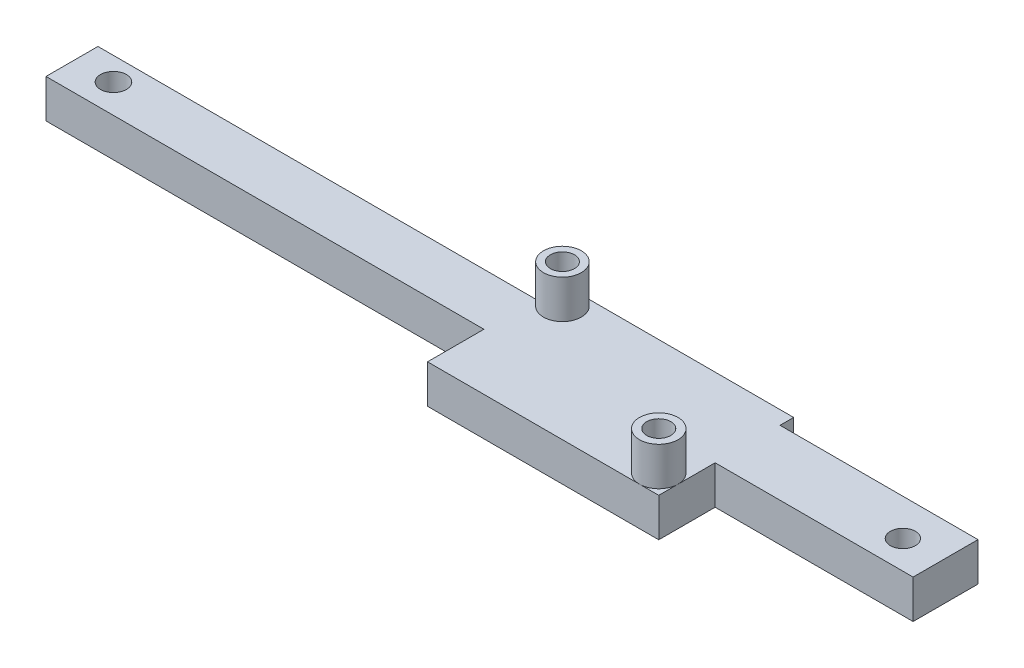
from build123d import *

# Parameters (mm, degrees)
SKETCH1_W           = 30.48
SKETCH1_H           = 17.78
BOSS_EXTRUDE1_DEPTH = 5.08
SKETCH3_R           = 1.5875
CUT_EXTRUDE1_DEPTH  = 36.101886702
BOSS_EXTRUDE2_START = 5.08
SKETCH4_R           = 2.496623085
SKETCH4_R_2         = 1.5875
SKETCH4_R_3         = 2.54
BOSS_EXTRUDE2_DEPTH = 5.08
SKETCH6_W           = 26.095055506
SKETCH6_H           = 8.553777079
SKETCH6_R           = 1.646398399
BOSS_EXTRUDE3_DEPTH = 5.08
SKETCH7_W           = 57.960584247
SKETCH7_H           = 6.84758287
SKETCH7_R           = 1.709119501
BOSS_EXTRUDE4_DEPTH = 5.08


with BuildPart() as part:
    # Sketch1 → Boss-Extrude1 (new body)
    with BuildSketch(Plane(origin=(0, 0, 0), x_dir=(1, 0, 0), z_dir=(0, 1, 0))):
        with Locations((14.675357499, -8.756740088)):
            Rectangle(SKETCH1_W, SKETCH1_H)
    extrude(amount=BOSS_EXTRUDE1_DEPTH)

    # Sketch3 → Cut-Extrude1 (cut, through all)
    with BuildSketch(Plane(origin=(0, 5.08, 0), x_dir=(1, 0, 0), z_dir=(0, 1, 0))):
        with Locations(Location((1.975357499, -2.406740088, 0), (0, 0, 270))):
            Circle(SKETCH3_R)
        with Locations(Location((27.375357499, -15.106740088, 0), (0, 0, 270))):
            Circle(SKETCH3_R)
    extrude(amount=-CUT_EXTRUDE1_DEPTH, mode=Mode.SUBTRACT)

    # Sketch4 → Boss-Extrude2 (add)
    # profile 1 of 2: a face of its own
    with BuildSketch(Plane(origin=(0, 5.08, 0), x_dir=(1, 0, 0), z_dir=(0, 1, 0)).offset(BOSS_EXTRUDE2_START)):
        with Locations(Location((1.975357499, -2.406740088, 0), (0, 0, 270))):
            Circle(SKETCH4_R)
        with Locations(Location((1.975357499, -2.406740088, 0), (0, 0, 270))):
            Circle(SKETCH4_R_2, mode=Mode.SUBTRACT)
    # profile 2 of 2: a face of its own
    with BuildSketch(Plane(origin=(0, 5.08, 0), x_dir=(1, 0, 0), z_dir=(0, 1, 0)).offset(BOSS_EXTRUDE2_START)):
        with Locations(Location((27.375357499, -15.106740088, 0), (0, 0, 270))):
            Circle(SKETCH4_R_3)
        with Locations(Location((27.375357499, -15.106740088, 0), (0, 0, 270))):
            Circle(SKETCH4_R_2, mode=Mode.SUBTRACT)
    extrude(amount=-BOSS_EXTRUDE2_DEPTH)

    # Sketch6 → Boss-Extrude3 (add)
    with BuildSketch(Plane(origin=(0, 5.08, 0), x_dir=(1, 0, 0), z_dir=(0, 1, 0))):
        with Locations((42.962885252, -5.938189685)):
            Rectangle(SKETCH6_W, SKETCH6_H)
        with Locations(Location((50.930413005, -6.484145564, 0), (0, 0, 270))):
            Circle(SKETCH6_R, mode=Mode.SUBTRACT)
    extrude(amount=-BOSS_EXTRUDE3_DEPTH)

    # Sketch7 → Boss-Extrude4 (add)
    with BuildSketch(Plane(origin=(0, 5.08, 0), x_dir=(1, 0, 0), z_dir=(0, 1, 0))):
        with Locations((-29.309294872, -6.791286789)):
            Rectangle(SKETCH7_W, SKETCH7_H)
        with Locations(Location((-53.209586995, -6.405078224, 0), (0, 0, 270))):
            Circle(SKETCH7_R, mode=Mode.SUBTRACT)
    extrude(amount=-BOSS_EXTRUDE4_DEPTH)


solid = part.part
